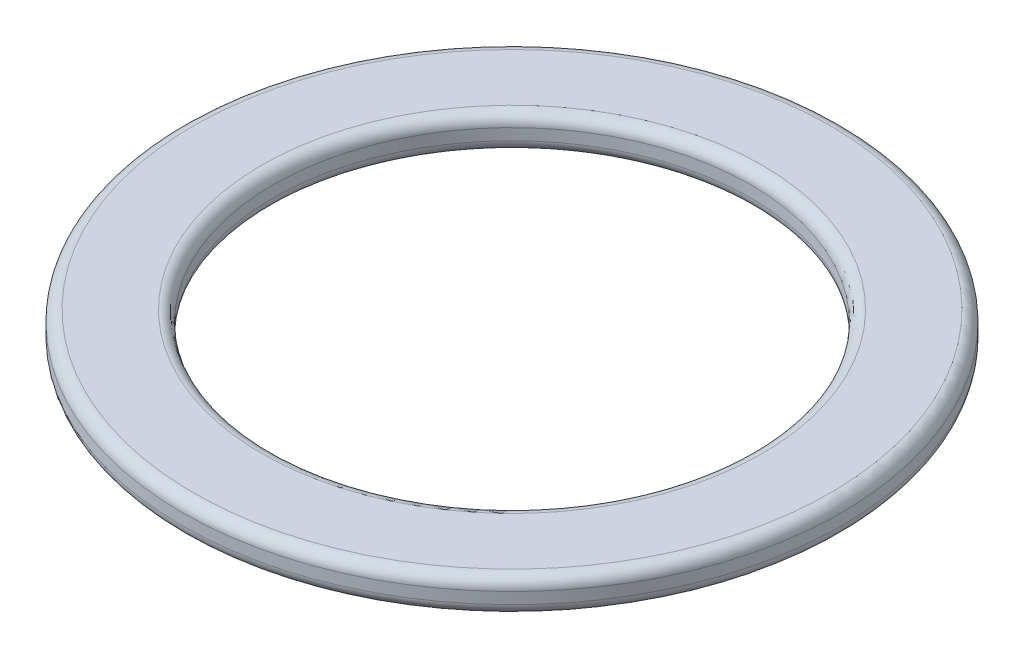
from build123d import *

# Parameters (mm, degrees)
SKETCH1_W = 8
SKETCH1_H = 3
FILLET1_R = 1


with BuildPart() as part:
    # Sketch1 → Revolve1 (revolve)
    with BuildSketch(Plane.XY, mode=Mode.PRIVATE) as revolve1_sk:
        with Locations((-25, 1.5)):
            Rectangle(SKETCH1_W, SKETCH1_H)
    revolve(revolve1_sk.sketch.rotate(Axis((0, 0, 0), (0, 1, 0)), 270), axis=Axis((0, 0, 0), (0, 1, 0)))

    # Fillet1
    fillet1_edges = [part.edges().sort_by_distance(p)[0] for p in [
        (0, 3, 21),
        (0, 3, 29),
        (0, 0, 29),
        (0, 0, 21),
    ]]
    fillet(fillet1_edges, radius=FILLET1_R)


solid = part.part
